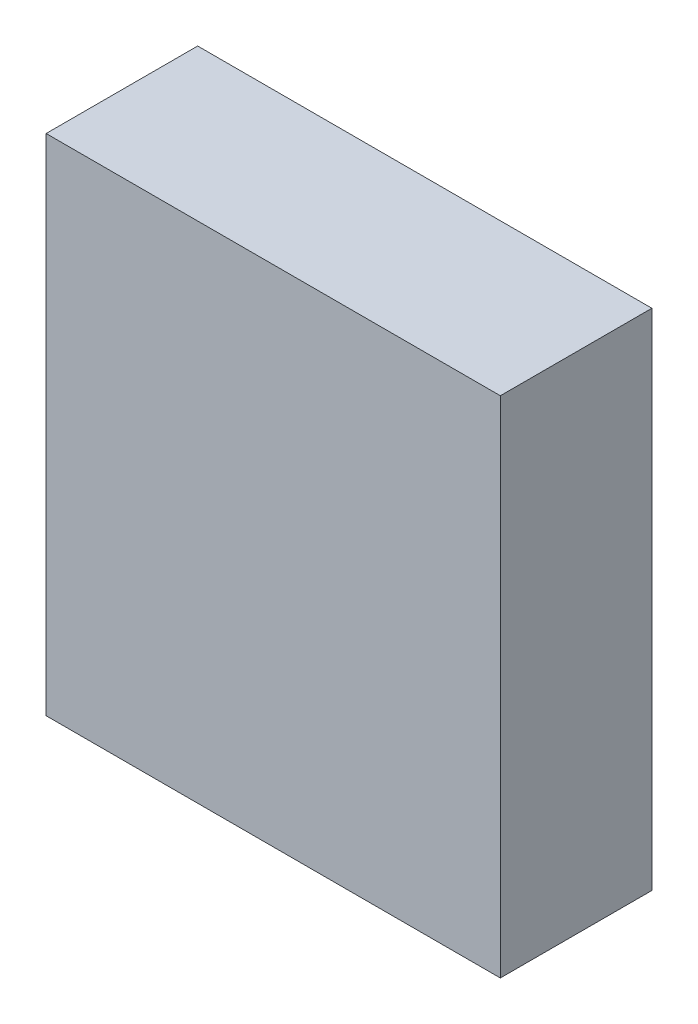
from build123d import *

# Parameters (mm, degrees)
SKETCH1_W               = 2.9972
SKETCH1_H               = 3.3274
COMPONENT_OUTLINE_DEPTH = 1


with BuildPart() as part:
    # Sketch1 → Component_Outline (new body)
    with BuildSketch(Plane.XY):
        with Locations((0, -0.0381)):
            Rectangle(SKETCH1_W, SKETCH1_H)
    extrude(amount=COMPONENT_OUTLINE_DEPTH)


solid = part.part
